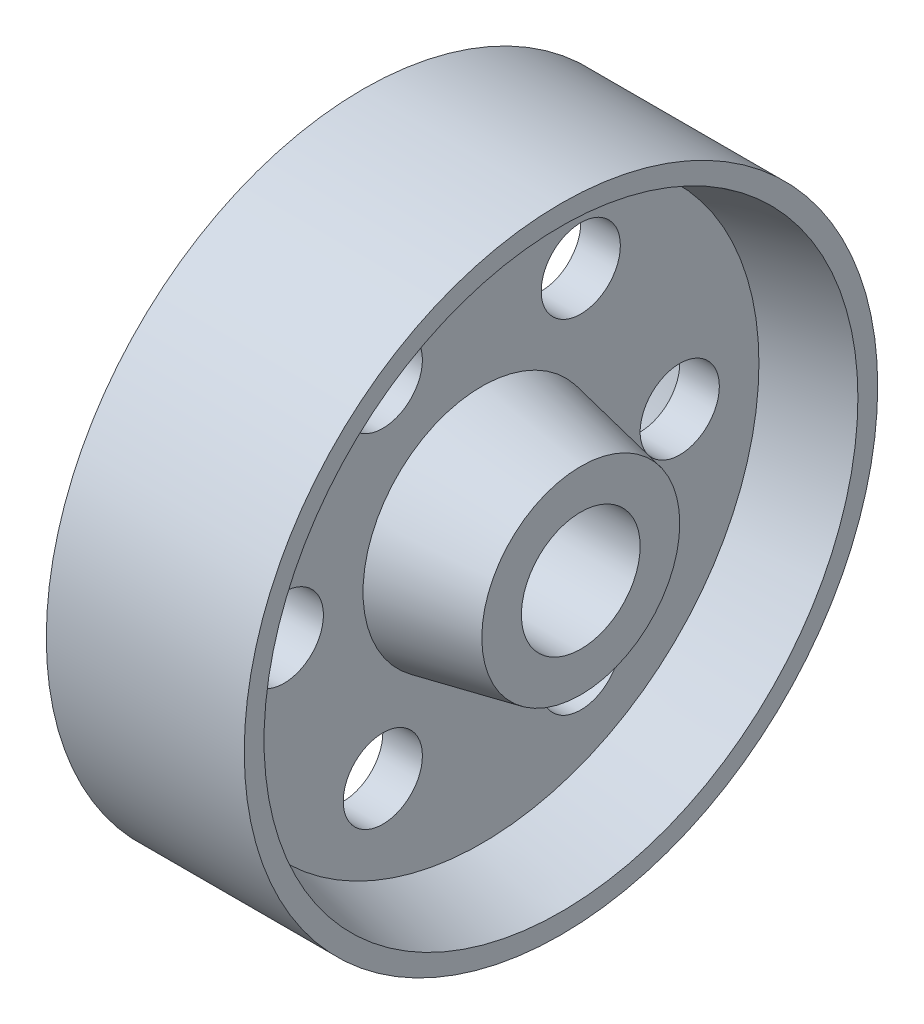
from build123d import *

# Parameters (mm, degrees)
SKETCH3_R          = 6.35
CUT_EXTRUDE1_DEPTH = 75.324844433


with BuildPart() as part:
    # Sketch2 → Revolve1 (revolve)
    with BuildSketch(Plane(origin=(0, 0, 0), x_dir=(-1, 0, 0), z_dir=(0, 1, 0)), mode=Mode.PRIVATE) as revolve1_sk:
        Polygon((15.875, 50.8), (0, 50.8), (0, 9.525), (19.05, 9.525), (19.05, 15.875), (3.175, 19.05), (3.175, 44.45), (15.875, 47.625), align=None)
    revolve(revolve1_sk.sketch.rotate(Axis((0, 0, 0), (-1, 0, 0)), 180), axis=Axis((0, 0, 0), (-1, 0, 0)))

    # Sketch3 → Cut-Extrude1 (cut, through all)
    with BuildSketch(Plane.YZ):
        with Locations(Location((0, 31.75, 0), (0, 0, 270))):
            Circle(SKETCH3_R)
        with Locations(Location((27.49630657, 15.875, 0), (0, 0, 270))):
            Circle(SKETCH3_R)
        with Locations(Location((27.49630657, -15.875, 0), (0, 0, 270))):
            Circle(SKETCH3_R)
        with Locations(Location((0, -31.75, 0), (0, 0, 270))):
            Circle(SKETCH3_R)
        with Locations(Location((-27.49630657, -15.875, 0), (0, 0, 270))):
            Circle(SKETCH3_R)
        with Locations(Location((-27.49630657, 15.875, 0), (0, 0, 270))):
            Circle(SKETCH3_R)
    extrude(amount=-CUT_EXTRUDE1_DEPTH, mode=Mode.SUBTRACT)

    # Mirror1: part across plane


with BuildPart() as part_1:
    add(part.part)
    add(part.part.mirror(Plane.ZY))


solid = part_1.part
